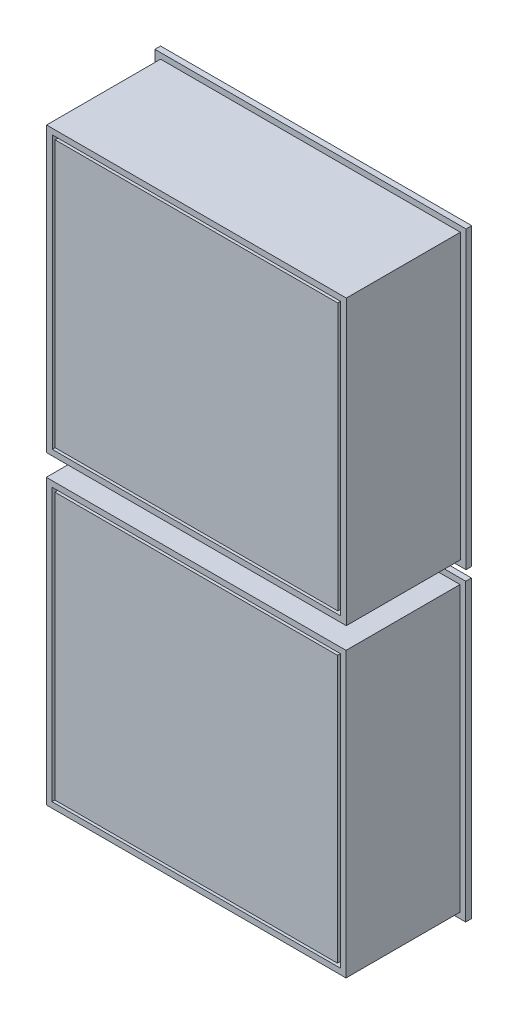
from build123d import *

# Parameters (mm, degrees)
SKETCH1_W             = 52.58415813
SKETCH1_H             = 49.778317302
BOSS_EXTRUDE1_DEPTH   = 20
SKETCH1_W_2           = 52.584158129
BOSS_EXTRUDE1_2_DEPTH = 20
SKETCH4_W             = 54.584158129
SKETCH4_H             = 51.778317302
BOSS_EXTRUDE2_DEPTH   = 1
SKETCH5_W             = 50.584158129
SKETCH5_H             = 47.778317302
SKETCH5_W_2           = 49.584158129
SKETCH5_H_2           = 46.778317302
CUT_EXTRUDE3_DEPTH    = 73.499422953
SKETCH6_W             = 54.58415813
SKETCH6_H             = 51.778317302
BOSS_EXTRUDE3_DEPTH   = 1
SKETCH7_W             = 50.58415813
SKETCH7_H             = 47.778317302
SKETCH7_W_2           = 49.58415813
SKETCH7_H_2           = 46.778317302
CUT_EXTRUDE4_DEPTH    = 74.400330453


with BuildPart() as part:
    # Sketch1 → Boss-Extrude1 (new body)
    with BuildSketch(Plane.XY):
        with Locations((-0.146707389, -38.869790603)):
            Rectangle(SKETCH1_W, SKETCH1_H)
    extrude(amount=BOSS_EXTRUDE1_DEPTH)

    # Sketch6 → Boss-Extrude3 (add, through all)
    with BuildSketch(Plane(origin=(0, 0, 0), x_dir=(-1, 0, 0), z_dir=(0, 0, -1))):
        with Locations((0.146707389, -38.869790603)):
            Rectangle(SKETCH6_W, SKETCH6_H)
    extrude(amount=BOSS_EXTRUDE3_DEPTH)

    # Sketch7 → Cut-Extrude4 (cut, through all)
    with BuildSketch(Plane(origin=(0, 0, -1), x_dir=(-1, 0, 0), z_dir=(0, 0, -1))):
        with Locations((0.146707389, -38.869790603)):
            Rectangle(SKETCH7_W, SKETCH7_H)
        with Locations((0.146707389, -38.869790603)):
            Rectangle(SKETCH7_W_2, SKETCH7_H_2, mode=Mode.SUBTRACT)
    extrude(amount=-CUT_EXTRUDE4_DEPTH, mode=Mode.SUBTRACT)


with BuildPart() as body_2:
    # Sketch1 → Boss-Extrude1 2 (new body)
    with BuildSketch(Plane.XY):
        with Locations((-0.093368138, 14.678326015)):
            Rectangle(SKETCH1_W_2, SKETCH1_H)
    extrude(amount=BOSS_EXTRUDE1_2_DEPTH)

    # Sketch4 → Boss-Extrude2 (add)
    with BuildSketch(Plane(origin=(0, 0, 0), x_dir=(-1, 0, 0), z_dir=(0, 0, -1))):
        with Locations((0.093368138, 14.678326015)):
            Rectangle(SKETCH4_W, SKETCH4_H)
    extrude(amount=BOSS_EXTRUDE2_DEPTH)

    # Sketch5 → Cut-Extrude3 (cut, through all)
    with BuildSketch(Plane(origin=(0, 0, -1), x_dir=(-1, 0, 0), z_dir=(0, 0, -1))):
        with Locations((0.093368138, 14.678326015)):
            Rectangle(SKETCH5_W, SKETCH5_H)
        with Locations((0.093368138, 14.678326015)):
            Rectangle(SKETCH5_W_2, SKETCH5_H_2, mode=Mode.SUBTRACT)
    extrude(amount=-CUT_EXTRUDE3_DEPTH, mode=Mode.SUBTRACT)


with BuildPart() as cut_extrude3_piece_1:
    # of the separate pieces the step leaves, piece 1, a body of its own (cut_extrude3_pieces)
    add(body_2.part.solids().sort_by_distance((-24.885447202, -8.710832636, -1))[0])


with BuildPart() as cut_extrude3_piece_2:
    # of the separate pieces the step leaves, piece 2, a body of its own (cut_extrude3_pieces)
    add(body_2.part.solids().sort_by_distance((-27.385447202, -11.210832636, 0))[0])


with BuildPart() as cut_extrude4_piece_1:
    # of the separate pieces the step leaves, piece 1, a body of its own (cut_extrude4_pieces)
    add(part.part.solids().sort_by_distance((24.645371676, -15.480631952, -1))[0])


with BuildPart() as cut_extrude4_piece_2:
    # of the separate pieces the step leaves, piece 2, a body of its own (cut_extrude4_pieces)
    add(part.part.solids().sort_by_distance((27.145371676, -64.758949254, 0))[0])


solid = Compound([cut_extrude3_piece_1.part, cut_extrude3_piece_2.part, cut_extrude4_piece_1.part, cut_extrude4_piece_2.part])
